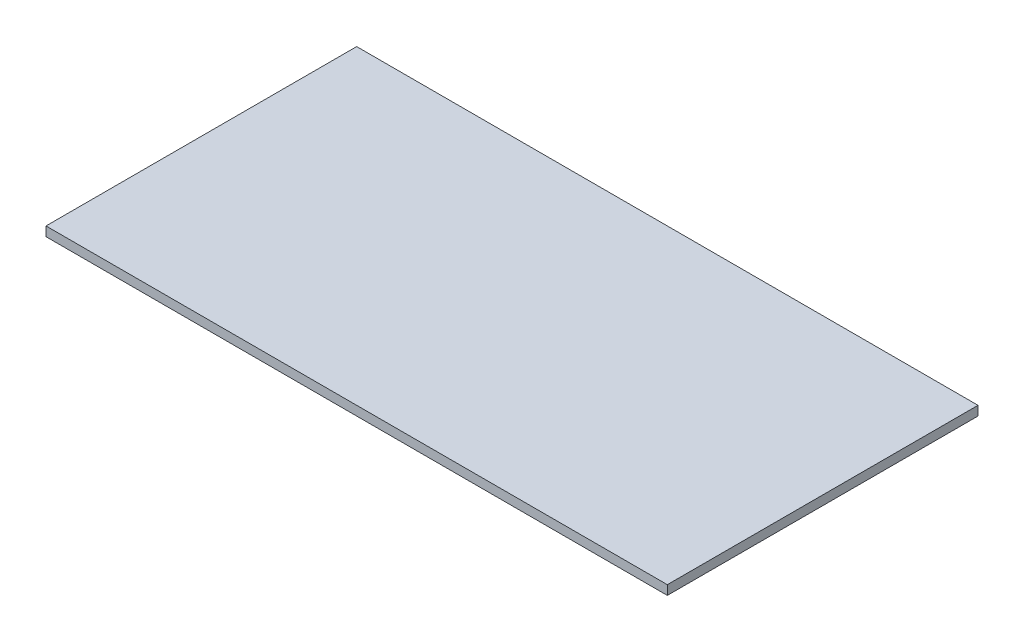
from build123d import *

# Parameters (mm, degrees)
SKETCH1_W           = 1000
SKETCH1_H           = 500
BOSS_EXTRUDE1_DEPTH = 15


with BuildPart() as part:
    # Sketch1 → Boss-Extrude1 (new body)
    with BuildSketch(Plane(origin=(0, 0, 0), x_dir=(1, 0, 0), z_dir=(0, 1, 0))):
        Rectangle(SKETCH1_W, SKETCH1_H)
    extrude(amount=BOSS_EXTRUDE1_DEPTH)


solid = part.part
